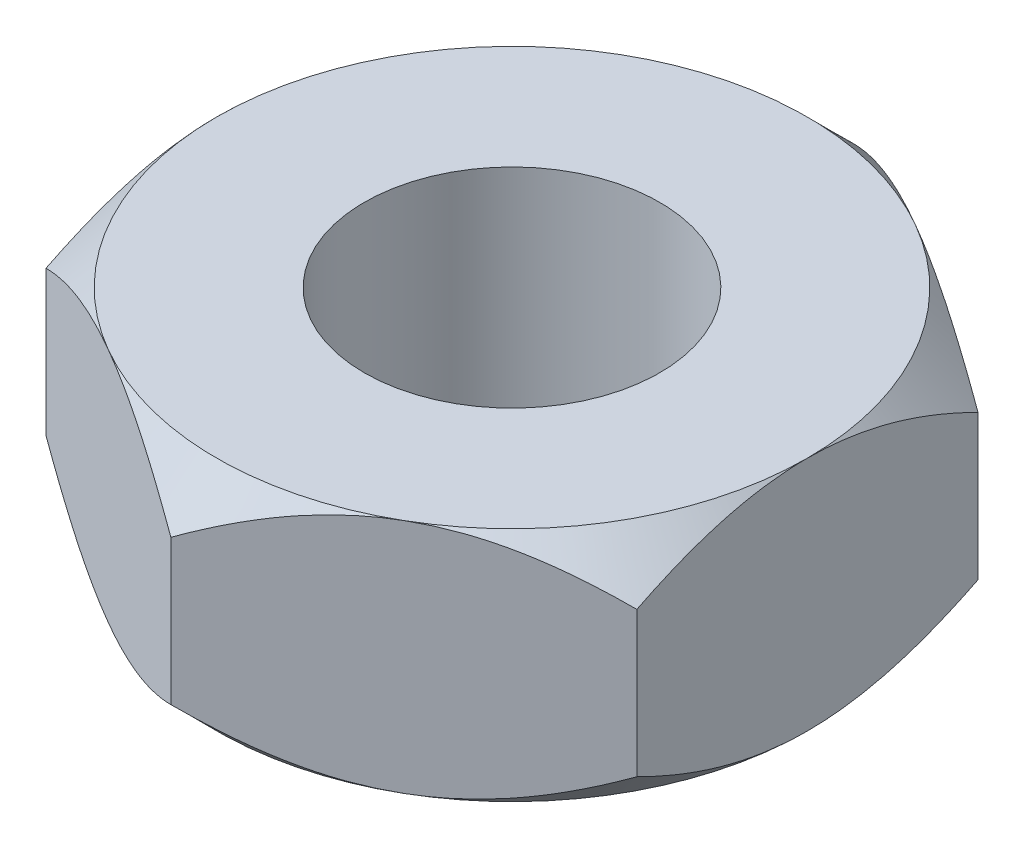
from build123d import *

# Parameters (mm, degrees)
SKETCH1_R           = 1.25
BOSS_EXTRUDE1_DEPTH = 2
SKETCH2_OUTSIDE_W   = 19.2
SKETCH2_OUTSIDE_H   = 19.974
SKETCH2_OUTSIDE_R   = 2.5
CUT_EXTRUDE1_DEPTH  = 5.310839052
CUT_EXTRUDE1_DRAFT  = -45
SKETCH3_OUTSIDE_W   = 19.2
SKETCH3_OUTSIDE_H   = 19.974
SKETCH3_OUTSIDE_R   = 2.5
CUT_EXTRUDE2_DEPTH  = 5.310839052
CUT_EXTRUDE2_DRAFT  = -45


with BuildPart() as part:
    # Sketch1 → Boss-Extrude1 (new body)
    with BuildSketch(Plane(origin=(0, 0, 0), x_dir=(1, 0, 0), z_dir=(0, 1, 0))):
        Polygon((0, 2.886751346), (-2.5, 1.443375673), (-2.5, -1.443375673), (0, -2.886751346), (2.5, -1.443375673), (2.5, 1.443375673), align=None)
        with Locations(Location((0, 0, 0), (0, 0, 270))):
            Circle(SKETCH1_R, mode=Mode.SUBTRACT)
    extrude(amount=BOSS_EXTRUDE1_DEPTH)


with BuildPart() as cut_extrude1_tool:
    # Sketch2 outside → Cut-Extrude1 (with draft: the straight prism first)
    with BuildSketch(Plane(origin=(0, 2, 0), x_dir=(1, 0, 0), z_dir=(0, 1, 0))):
        Rectangle(SKETCH2_OUTSIDE_W, SKETCH2_OUTSIDE_H)
        Circle(SKETCH2_OUTSIDE_R, mode=Mode.SUBTRACT)
    extrude(amount=-CUT_EXTRUDE1_DEPTH)
    # Cut-Extrude1: the draft: its side faces are tilted about the plane it starts from
    cut_extrude1_sides = [cut_extrude1_tool.faces().sort_by_distance(p)[0] for p in [
        (0, -0.655419526, 9.987),
        (9.6, -0.655419526, 0),
        (0, -0.655419526, -9.987),
        (-9.6, -0.655419526, 0),
        (-2.5, -0.655419526, 0),
    ]]
    draft(cut_extrude1_sides, Plane(origin=(0, 2, 0), x_dir=(1, 0, 0), z_dir=(0, 1, 0)), CUT_EXTRUDE1_DRAFT)


with BuildPart() as part_1:
    add(part.part)

    # Cut-Extrude1: cut by cut_extrude1_tool
    add(cut_extrude1_tool.part, mode=Mode.SUBTRACT)


with BuildPart() as cut_extrude2_tool:
    # Sketch3 outside → Cut-Extrude2 (with draft: the straight prism first)
    with BuildSketch(Plane.XZ):
        Rectangle(SKETCH3_OUTSIDE_W, SKETCH3_OUTSIDE_H)
        Circle(SKETCH3_OUTSIDE_R, mode=Mode.SUBTRACT)
    extrude(amount=-CUT_EXTRUDE2_DEPTH)
    # Cut-Extrude2: the draft: its side faces are tilted about the plane it starts from
    cut_extrude2_sides = [cut_extrude2_tool.faces().sort_by_distance(p)[0] for p in [
        (0, 2.655419526, -9.987),
        (9.6, 2.655419526, 0),
        (0, 2.655419526, 9.987),
        (-9.6, 2.655419526, 0),
        (-2.5, 2.655419526, 0),
    ]]
    draft(cut_extrude2_sides, Plane.XZ, CUT_EXTRUDE2_DRAFT)


with BuildPart() as part_2:
    add(part_1.part)

    # Cut-Extrude2: cut by cut_extrude2_tool
    add(cut_extrude2_tool.part, mode=Mode.SUBTRACT)


solid = part_2.part
